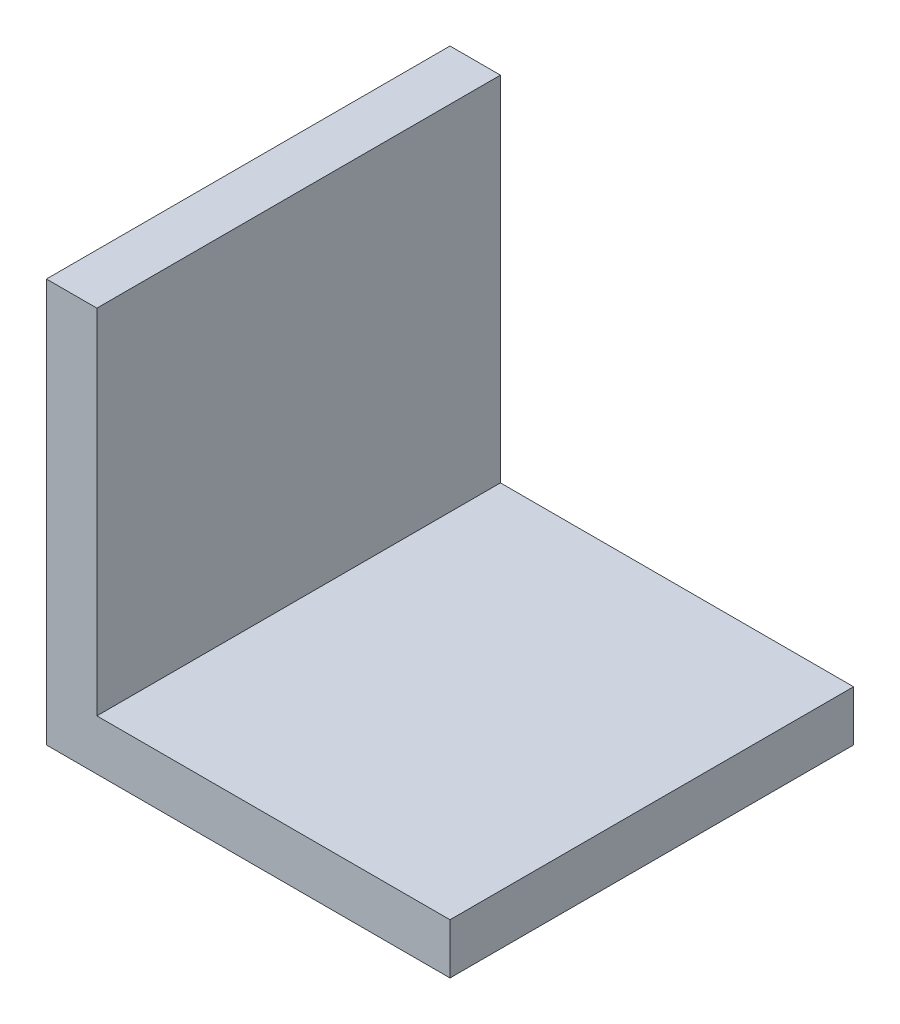
from build123d import *

# Parameters (mm, degrees)
BOSS_EXTRUDE1_DEPTH = 25.4


with BuildPart() as part:
    # Sketch1 → Boss-Extrude1 (new body)
    with BuildSketch(Plane.XY):
        Polygon((0, 0), (0, 25.4), (3.175, 25.4), (3.175, 3.175), (25.4, 3.175), (25.4, 0), align=None)
    extrude(amount=BOSS_EXTRUDE1_DEPTH)


solid = part.part
